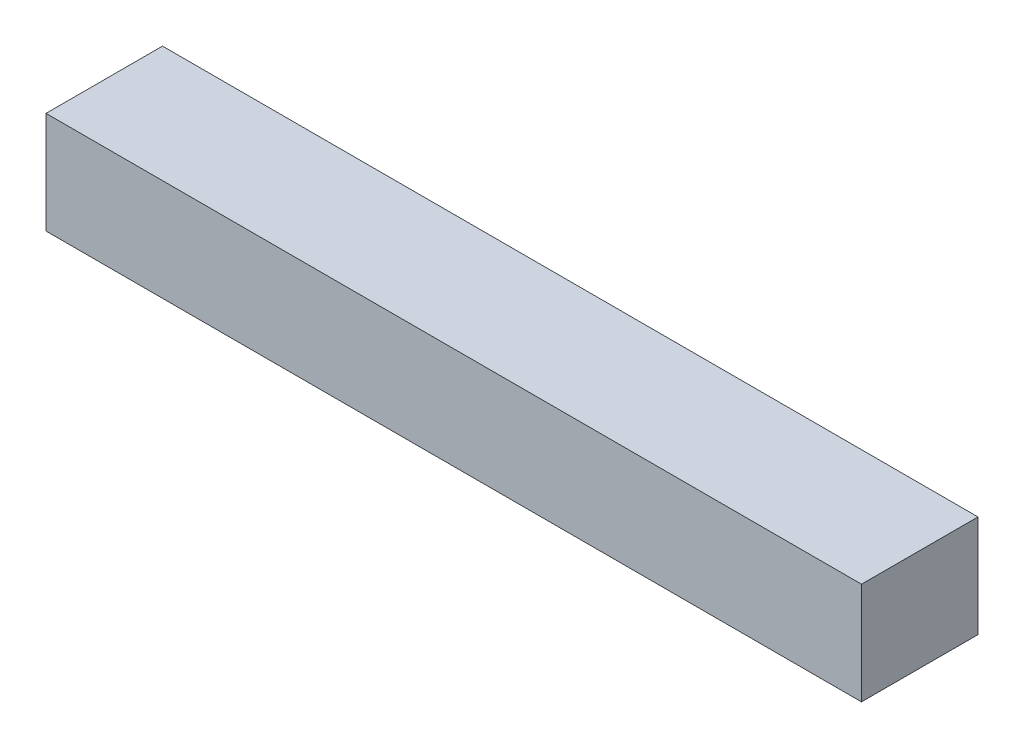
from build123d import *

# Parameters (mm, degrees)
SKETCH1_W           = 8
SKETCH1_H           = 7
BOSS_EXTRUDE1_DEPTH = 56
ESCALA1_SCALE       = 0.5


with BuildPart() as part:
    # Sketch1 → Boss-Extrude1 (new body)
    with BuildSketch(Plane(origin=(0, 0, 0), x_dir=(0, 0, -1), z_dir=(1, 0, 0))):
        with Locations((-11.670398622, -7.549640054)):
            Rectangle(SKETCH1_W, SKETCH1_H)
    extrude(amount=BOSS_EXTRUDE1_DEPTH)


with BuildPart() as part_1:
    # Escala1: scaled about (28, -7.549640054, 11.670398622)
    add(part.part.scale(ESCALA1_SCALE).moved(Location((14, -3.774820027, 5.835199311))))


solid = part_1.part
